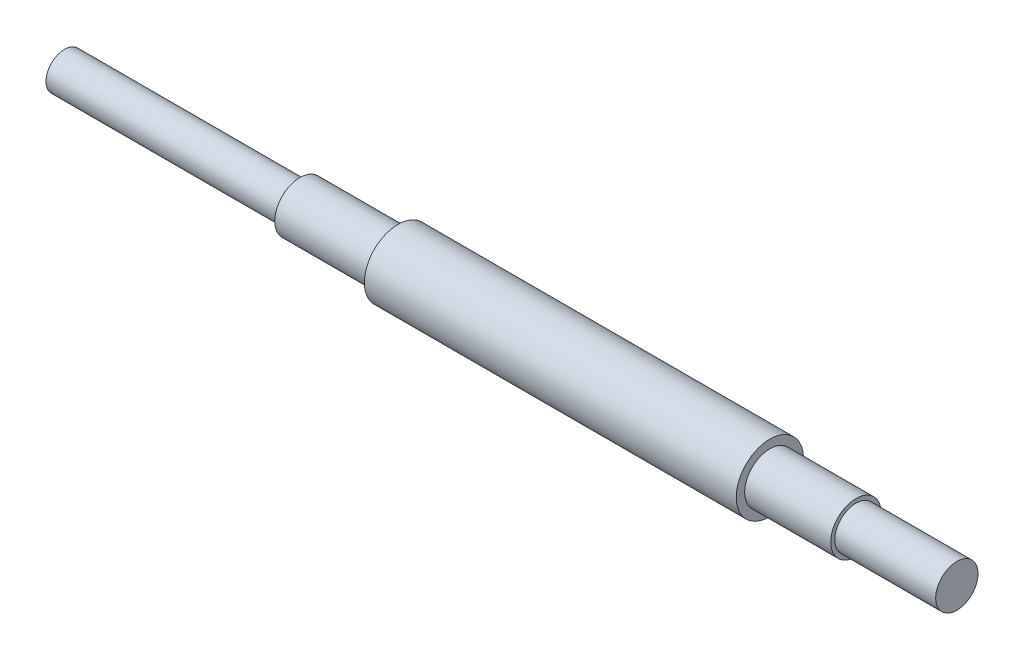
from build123d import *


with BuildPart() as part:
    # Sketch1 → Revolve1 (revolve)
    with BuildSketch(Plane(origin=(0, 0, 0), x_dir=(1, 0, 0), z_dir=(0, 1, 0)), mode=Mode.PRIVATE) as revolve1_sk:
        Polygon((-78.63058905, 0), (-78.63058905, 3.499993), (-34.18058905, 3.499993), (-34.18058905, 4.7625), (-15.668878296, 4.7625), (-15.668878296, 6.35), (54.549370904, 6.35), (54.549370904, 4.7625), (70.805370904, 4.7625), (70.805370904, 3.99923), (89.855370904, 3.99923), (89.855370904, 0), align=None)
    revolve(revolve1_sk.sketch.rotate(Axis((-97.950567047, 0, 0), (1, 0, 0)), 180), axis=Axis((-97.950567047, 0, 0), (1, 0, 0)))


solid = part.part
